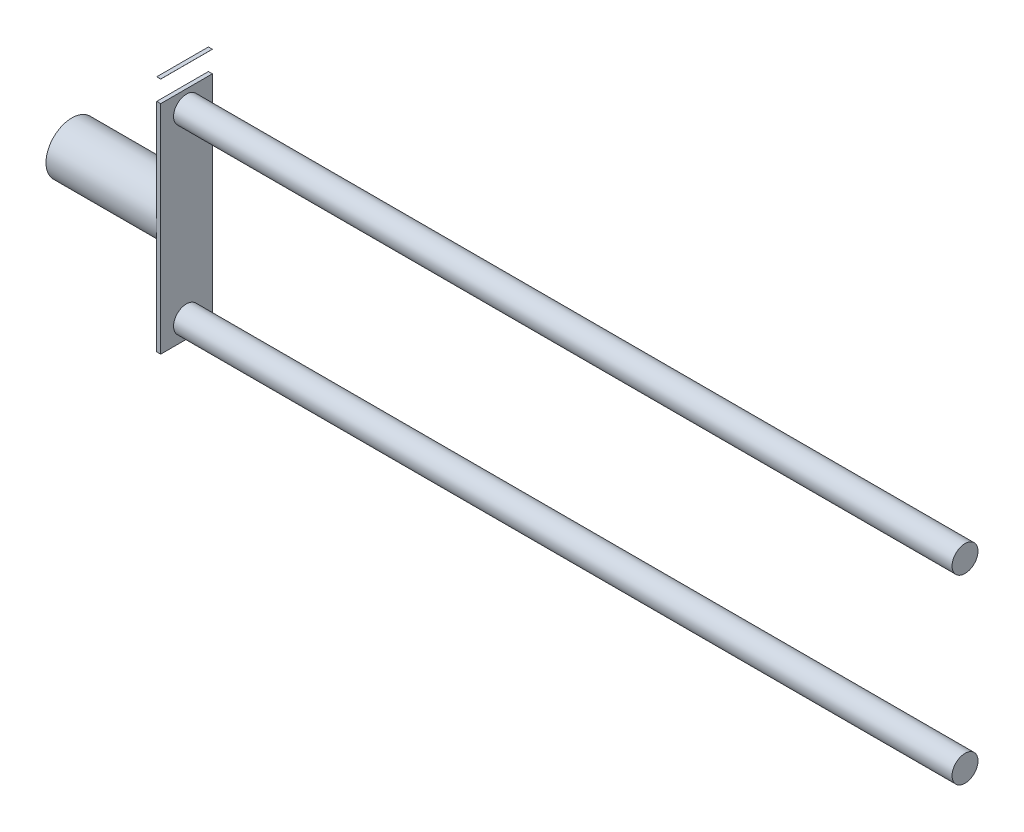
from build123d import *

# Parameters (mm, degrees)
SKETCH1_W           = 42.676374934
SKETCH1_H           = 9.951050175
SKETCH2_W           = 1.52161308
SKETCH2_H           = 19.90210035
BOSS_EXTRUDE1_DEPTH = 50
SKETCH3_R           = 5
BOSS_EXTRUDE2_DEPTH = 300
SKETCH4_W           = 19.90210035
SKETCH4_H           = 8.176332163
CUT_EXTRUDE1_DEPTH  = 305.300876436


with BuildPart() as part:
    # Sketch1 → Revolve1 (revolve)
    with BuildSketch(Plane.XY):
        with Locations((83.520419131, 4.975525088)):
            Rectangle(SKETCH1_W, SKETCH1_H)
    revolve(axis=Axis((62.182231664, 0, 0), (1, 0, 0)))

    # Sketch2 → Boss-Extrude1 (add, symmetric)
    with BuildSketch(Plane(origin=(0, 0, 0), x_dir=(1, 0, 0), z_dir=(0, 1, 0))):
        with Locations((105.619413138, 0)):
            Rectangle(SKETCH2_W, SKETCH2_H)
    extrude(amount=BOSS_EXTRUDE1_DEPTH, both=True)

    # Sketch3 → Boss-Extrude2 (add)
    with BuildSketch(Plane(origin=(106.380219678, 0, 0), x_dir=(0, 0, -1), z_dir=(1, 0, 0))):
        with Locations((0, 35)):
            Circle(SKETCH3_R)
        with Locations((0, -35)):
            Circle(SKETCH3_R)
    extrude(amount=BOSS_EXTRUDE2_DEPTH)

    # Sketch4 → Cut-Extrude1 (cut, through all)
    with BuildSketch(Plane(origin=(106.380219678, 0, 0), x_dir=(0, 0, -1), z_dir=(1, 0, 0))):
        with Locations((0, -45.911833919)):
            Rectangle(SKETCH4_W, SKETCH4_H)
        with Locations((0, 45.886757364)):
            Rectangle(SKETCH4_W, SKETCH4_H)
    extrude(amount=-CUT_EXTRUDE1_DEPTH, mode=Mode.SUBTRACT)


with BuildPart() as cut_extrude1_piece_1:
    # of the separate pieces the step leaves, piece 1, a body of its own (cut_extrude1_pieces)
    add(part.part.solids().sort_by_distance((104.858606598, 9.951050175, 0))[0])


with BuildPart() as cut_extrude1_piece_2:
    # of the separate pieces the step leaves, piece 2, a body of its own (cut_extrude1_pieces)
    add(part.part.solids().sort_by_distance((104.858606598, 49.974923446, 9.951050175))[0])


solid = Compound([cut_extrude1_piece_1.part, cut_extrude1_piece_2.part])
